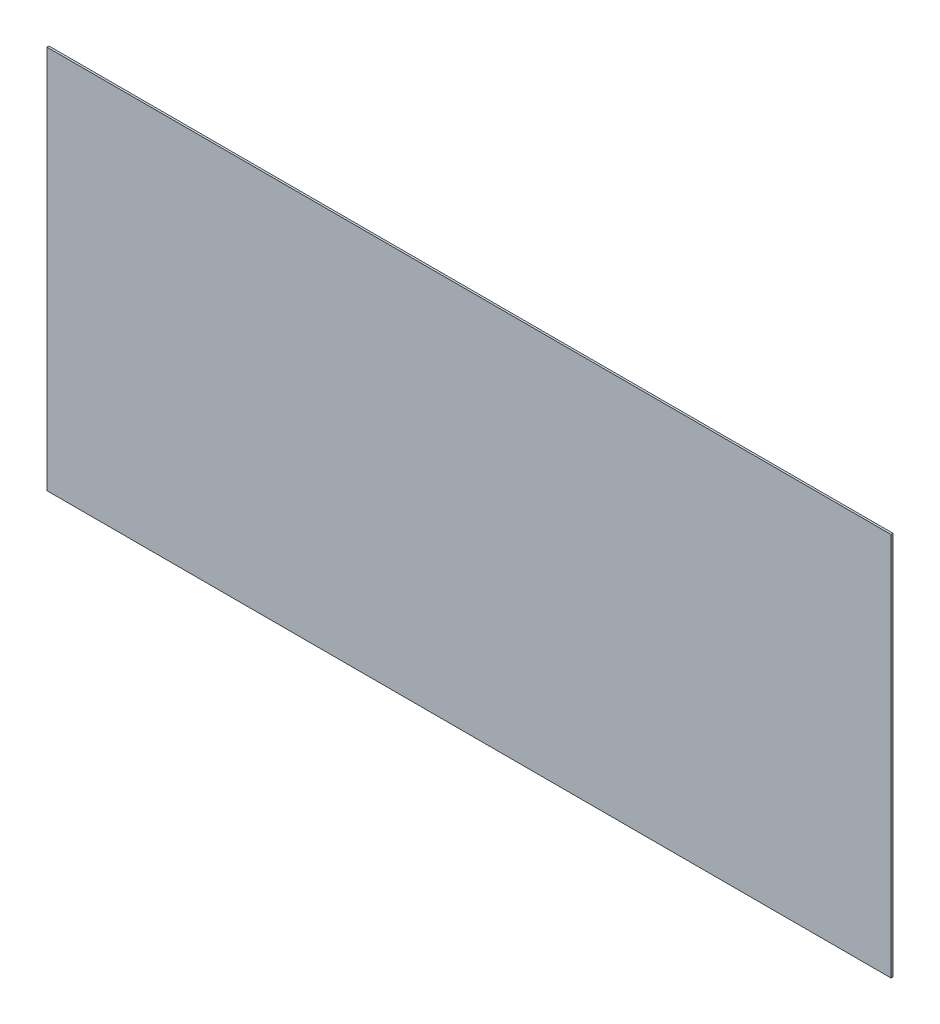
from build123d import *

# Parameters (mm, degrees)
STORE_PANEL_BOS_BANT_1_START = 38.5
SKETCH1_W                    = 624
SKETCH1_H                    = 284
STORE_PANEL_BOS_BANT_1_DEPTH = 1.5


with BuildPart() as part:
    # Sketch1 → STORE_panel_bos_bant_1 (new body)
    with BuildSketch(Plane.XY.offset(STORE_PANEL_BOS_BANT_1_START)):
        with Locations((1026, 545)):
            Rectangle(SKETCH1_W, SKETCH1_H)
    extrude(amount=STORE_PANEL_BOS_BANT_1_DEPTH)


solid = part.part
